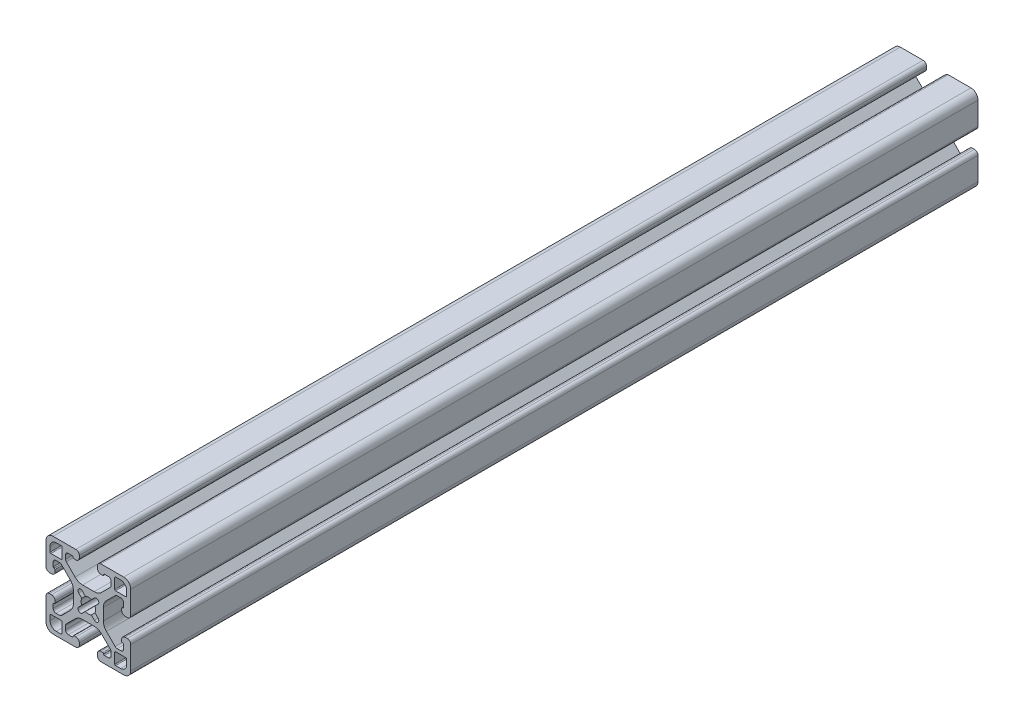
from build123d import *

# Parameters (mm, degrees)
EXTRUDE1_DEPTH = 381


with BuildPart() as part:
    # Sketch1 → Extrude1 (new body)
    with BuildSketch(Plane.XY):
        with BuildLine():
            Line((-46.536752228, -7.000622168), (-46.536752228, -8.774580164))
            ThreePointArc((-46.536752228, -8.774580164), (-46.907290083, -9.675221514), (-47.806745776, -10.048628264))
            Line((-47.806745776, -10.048628264), (-49.392633083, -10.048628264))
            ThreePointArc((-49.392633083, -10.048628264), (-49.878641042, -9.95195527), (-50.290658695, -9.676653876))
            Line((-50.290658695, -9.676653876), (-54.238761565, -5.728551005))
            ThreePointArc((-54.238761565, -5.728551005), (-55.26838878, -4.187604983), (-55.629945776, -2.369935216))
            Line((-55.629945776, -2.369935216), (-55.629945776, 2.846678689))
            ThreePointArc((-55.629945776, 2.846678689), (-55.26838878, 4.664348456), (-54.238761565, 6.205294478))
            Line((-54.238761565, 6.205294478), (-50.290658695, 10.153397348))
            ThreePointArc((-50.290658695, 10.153397348), (-49.878641042, 10.428698742), (-49.392633083, 10.525371736))
            Line((-49.392633083, 10.525371736), (-47.806745776, 10.525371736))
            ThreePointArc((-47.806745776, 10.525371736), (-46.907290079, 10.151964982), (-46.536752228, 9.251323623))
            Line((-46.536752228, 9.251323623), (-46.536752228, 7.47736564))
            ThreePointArc((-46.536752228, 7.47736564), (-46.648344767, 7.207957418), (-46.91775299, 7.096364878))
            Line((-46.91775299, 7.096364878), (-46.993953142, 7.096364878))
            ThreePointArc((-46.993953142, 7.096364878), (-47.263362671, 6.984771032), (-47.374953904, 6.715360422))
            Line((-47.374953904, 6.715360422), (-47.374945776, 5.877156465))
            ThreePointArc((-47.374945776, 5.877156465), (-46.913692136, 4.763614578), (-45.800145776, 4.302371736))
            Line((-45.800145776, 4.302371736), (-44.885745776, 4.302371736))
            ThreePointArc((-44.885745776, 4.302371736), (-43.772194017, 4.763619977), (-43.310945776, 5.877171736))
            Line((-43.310945776, 5.877171736), (-43.310945776, 16.113371736))
            ThreePointArc((-43.310945776, 16.113371736), (-44.240881746, 18.358435766), (-46.485945776, 19.288371736))
            Line((-46.485945776, 19.288371736), (-56.722145776, 19.288371736))
            ThreePointArc((-56.722145776, 19.288371736), (-57.835697535, 18.827123495), (-58.296945776, 17.713571736))
            Line((-58.296945776, 17.713571736), (-58.296945776, 16.799171736))
            ThreePointArc((-58.296945776, 16.799171736), (-57.835702934, 15.685625376), (-56.722161047, 15.224371736))
            Line((-56.722161047, 15.224371736), (-55.883957091, 15.224363608))
            ThreePointArc((-55.883957091, 15.224363608), (-55.61454648, 15.335954841), (-55.502952634, 15.60536437))
            Line((-55.502952634, 15.60536437), (-55.502952634, 15.681564523))
            ThreePointArc((-55.502952634, 15.681564523), (-55.391360095, 15.950972745), (-55.121951872, 16.062565285))
            Line((-55.121951872, 16.062565285), (-53.347993876, 16.062565285))
            ThreePointArc((-53.347993876, 16.062565285), (-52.447352526, 15.692027429), (-52.073945776, 14.792571736))
            Line((-52.073945776, 14.792571736), (-52.073945776, 13.206684429))
            ThreePointArc((-52.073945776, 13.206684429), (-52.17061877, 12.72067647), (-52.445920164, 12.308658817))
            Line((-52.445920164, 12.308658817), (-56.394023034, 8.360555947))
            ThreePointArc((-56.394023034, 8.360555947), (-57.934969057, 7.330928733), (-59.752638824, 6.969371736))
            Line((-59.752638824, 6.969371736), (-64.969252728, 6.969371736))
            ThreePointArc((-64.969252728, 6.969371736), (-66.786922496, 7.330928733), (-68.327868518, 8.360555947))
            Line((-68.327868518, 8.360555947), (-72.275971388, 12.308658817))
            ThreePointArc((-72.275971388, 12.308658817), (-72.551272782, 12.72067647), (-72.647945776, 13.206684429))
            Line((-72.647945776, 13.206684429), (-72.647945776, 14.792571736))
            ThreePointArc((-72.647945776, 14.792571736), (-72.274539022, 15.692027434), (-71.373897663, 16.062565285))
            Line((-71.373897663, 16.062565285), (-69.59993968, 16.062565285))
            ThreePointArc((-69.59993968, 16.062565285), (-69.330531458, 15.950972745), (-69.218938918, 15.681564523))
            Line((-69.218938918, 15.681564523), (-69.218938918, 15.60536437))
            ThreePointArc((-69.218938918, 15.60536437), (-69.107345072, 15.335954841), (-68.837934461, 15.224363608))
            Line((-68.837934461, 15.224363608), (-67.999730505, 15.224371736))
            ThreePointArc((-67.999730505, 15.224371736), (-66.886188618, 15.685625376), (-66.424945776, 16.799171736))
            Line((-66.424945776, 16.799171736), (-66.424945776, 17.713571736))
            ThreePointArc((-66.424945776, 17.713571736), (-66.886194017, 18.827123495), (-67.999745776, 19.288371736))
            Line((-67.999745776, 19.288371736), (-78.235945776, 19.288371736))
            ThreePointArc((-78.235945776, 19.288371736), (-80.481009806, 18.358435766), (-81.410945776, 16.113371736))
            Line((-81.410945776, 16.113371736), (-81.410945776, 5.877171736))
            ThreePointArc((-81.410945776, 5.877171736), (-80.949697535, 4.763619977), (-79.836145776, 4.302371736))
            Line((-79.836145776, 4.302371736), (-78.921745776, 4.302371736))
            ThreePointArc((-78.921745776, 4.302371736), (-77.808199416, 4.763614578), (-77.346945776, 5.877156465))
            Line((-77.346945776, 5.877156465), (-77.346937648, 6.715360422))
            ThreePointArc((-77.346937648, 6.715360422), (-77.458528881, 6.984771032), (-77.72793841, 7.096364878))
            Line((-77.72793841, 7.096364878), (-77.804138562, 7.096364878))
            ThreePointArc((-77.804138562, 7.096364878), (-78.073546785, 7.207957418), (-78.185139324, 7.47736564))
            Line((-78.185139324, 7.47736564), (-78.185139324, 9.251323637))
            ThreePointArc((-78.185139324, 9.251323637), (-77.814601469, 10.151964987), (-76.915145776, 10.525371736))
            Line((-76.915145776, 10.525371736), (-75.329258469, 10.525371736))
            ThreePointArc((-75.329258469, 10.525371736), (-74.84325051, 10.428698742), (-74.431232857, 10.153397348))
            Line((-74.431232857, 10.153397348), (-70.483129987, 6.205294478))
            ThreePointArc((-70.483129987, 6.205294478), (-69.453502773, 4.664348456), (-69.091945776, 2.846678689))
            Line((-69.091945776, 2.846678689), (-69.091945776, -2.369935216))
            ThreePointArc((-69.091945776, -2.369935216), (-69.453502773, -4.187604983), (-70.483129987, -5.728551005))
            Line((-70.483129987, -5.728551005), (-74.431232857, -9.676653876))
            ThreePointArc((-74.431232857, -9.676653876), (-74.84325051, -9.95195527), (-75.329258469, -10.048628264))
            Line((-75.329258469, -10.048628264), (-76.915145776, -10.048628264))
            ThreePointArc((-76.915145776, -10.048628264), (-77.814601474, -9.67522151), (-78.185139324, -8.774580151))
            Line((-78.185139324, -8.774580151), (-78.185139324, -7.000622168))
            ThreePointArc((-78.185139324, -7.000622168), (-78.073546785, -6.731213945), (-77.804138562, -6.619621406))
            Line((-77.804138562, -6.619621406), (-77.72793841, -6.619621406))
            ThreePointArc((-77.72793841, -6.619621406), (-77.458528881, -6.50802756), (-77.346937648, -6.238616949))
            Line((-77.346937648, -6.238616949), (-77.346945776, -5.400412993))
            ThreePointArc((-77.346945776, -5.400412993), (-77.808199416, -4.286871106), (-78.921745776, -3.825628264))
            Line((-78.921745776, -3.825628264), (-79.836145776, -3.825628264))
            ThreePointArc((-79.836145776, -3.825628264), (-80.949697535, -4.286876505), (-81.410945776, -5.400428264))
            Line((-81.410945776, -5.400428264), (-81.410945776, -15.636628264))
            ThreePointArc((-81.410945776, -15.636628264), (-80.481009806, -17.881692294), (-78.235945776, -18.811628264))
            Line((-78.235945776, -18.811628264), (-67.999745776, -18.811628264))
            ThreePointArc((-67.999745776, -18.811628264), (-66.886194017, -18.350380023), (-66.424945776, -17.236828264))
            Line((-66.424945776, -17.236828264), (-66.424945776, -16.322428264))
            ThreePointArc((-66.424945776, -16.322428264), (-66.886188618, -15.208881904), (-67.999730505, -14.747628264))
            Line((-67.999730505, -14.747628264), (-68.837934461, -14.747620136))
            ThreePointArc((-68.837934461, -14.747620136), (-69.107345072, -14.859211369), (-69.218938918, -15.128620898))
            Line((-69.218938918, -15.128620898), (-69.218938918, -15.20482105))
            ThreePointArc((-69.218938918, -15.20482105), (-69.330531458, -15.474229273), (-69.59993968, -15.585821812))
            Line((-69.59993968, -15.585821812), (-71.373897676, -15.585821812))
            ThreePointArc((-71.373897676, -15.585821812), (-72.274539027, -15.215283957), (-72.647945776, -14.315828264))
            Line((-72.647945776, -14.315828264), (-72.647945776, -12.729940957))
            ThreePointArc((-72.647945776, -12.729940957), (-72.551272782, -12.243932998), (-72.275971388, -11.831915345))
            Line((-72.275971388, -11.831915345), (-68.327868518, -7.883812475))
            ThreePointArc((-68.327868518, -7.883812475), (-66.786922496, -6.85418526), (-64.969252728, -6.492628264))
            Line((-64.969252728, -6.492628264), (-59.752638824, -6.492628264))
            ThreePointArc((-59.752638824, -6.492628264), (-57.934969057, -6.85418526), (-56.394023034, -7.883812475))
            Line((-56.394023034, -7.883812475), (-52.445920164, -11.831915345))
            ThreePointArc((-52.445920164, -11.831915345), (-52.17061877, -12.243932998), (-52.073945776, -12.729940957))
            Line((-52.073945776, -12.729940957), (-52.073945776, -14.315828264))
            ThreePointArc((-52.073945776, -14.315828264), (-52.44735253, -15.215283961), (-53.347993889, -15.585821812))
            Line((-53.347993889, -15.585821812), (-55.121951872, -15.585821812))
            ThreePointArc((-55.121951872, -15.585821812), (-55.391360095, -15.474229273), (-55.502952634, -15.20482105))
            Line((-55.502952634, -15.20482105), (-55.502952634, -15.128620898))
            ThreePointArc((-55.502952634, -15.128620898), (-55.61454648, -14.859211369), (-55.883957091, -14.747620136))
            Line((-55.883957091, -14.747620136), (-56.722161047, -14.747628264))
            ThreePointArc((-56.722161047, -14.747628264), (-57.835702934, -15.208881904), (-58.296945776, -16.322428264))
            Line((-58.296945776, -16.322428264), (-58.296945776, -17.236828264))
            ThreePointArc((-58.296945776, -17.236828264), (-57.835697535, -18.350380023), (-56.722145776, -18.811628264))
            Line((-56.722145776, -18.811628264), (-46.485945776, -18.811628264))
            ThreePointArc((-46.485945776, -18.811628264), (-44.240881746, -17.881692294), (-43.310945776, -15.636628264))
            Line((-43.310945776, -15.636628264), (-43.310945776, -5.400428264))
            ThreePointArc((-43.310945776, -5.400428264), (-43.772194017, -4.286876505), (-44.885745776, -3.825628264))
            Line((-44.885745776, -3.825628264), (-45.800145776, -3.825628264))
            ThreePointArc((-45.800145776, -3.825628264), (-46.913692136, -4.286871106), (-47.374945776, -5.400412993))
            Line((-47.374945776, -5.400412993), (-47.374953904, -6.238616949))
            ThreePointArc((-47.374953904, -6.238616949), (-47.263362671, -6.50802756), (-46.993953142, -6.619621406))
            Line((-46.993953142, -6.619621406), (-46.91775299, -6.619621406))
            ThreePointArc((-46.91775299, -6.619621406), (-46.648344767, -6.731213945), (-46.536752228, -7.000622168))
        make_face()
        with BuildLine():
            Line((-66.704246649, -2.488483035), (-65.333825803, -1.118062189))
            ThreePointArc((-65.333825803, -1.118062189), (-65.628655776, 0.238371736), (-65.333825803, 1.594805661))
            Line((-65.333825803, 1.594805661), (-66.704246649, 2.965226507))
            ThreePointArc((-66.704246649, 2.965226507), (-66.704246649, 4.581672609), (-65.087800547, 4.581672609))
            Line((-65.087800547, 4.581672609), (-63.717379701, 3.211251763))
            ThreePointArc((-63.717379701, 3.211251763), (-62.360945776, 3.506081736), (-61.004511851, 3.211251763))
            Line((-61.004511851, 3.211251763), (-59.721184579, 4.483982556))
            ThreePointArc((-59.721184579, 4.483982556), (-58.017644903, 4.581672609), (-58.115334956, 2.878132934))
            Line((-58.115334956, 2.878132934), (-59.38806575, 1.594805661))
            ThreePointArc((-59.38806575, 1.594805661), (-59.093235776, 0.238371736), (-59.38806575, -1.118062189))
            Line((-59.38806575, -1.118062189), (-58.017644903, -2.488483035))
            ThreePointArc((-58.017644903, -2.488483035), (-58.017644903, -4.104929137), (-59.634091005, -4.104929137))
            Line((-59.634091005, -4.104929137), (-61.004511851, -2.73450829))
            ThreePointArc((-61.004511851, -2.73450829), (-62.360945776, -3.029338264), (-63.717379701, -2.73450829))
            Line((-63.717379701, -2.73450829), (-65.087800547, -4.104929137))
            ThreePointArc((-65.087800547, -4.104929137), (-66.704246649, -4.104929137), (-66.704246649, -2.488483035))
        make_face(mode=Mode.SUBTRACT)
        with BuildLine():
            Line((-79.607545776, 12.481171736), (-79.607545776, 14.690971736))
            ThreePointArc((-79.607545776, 14.690971736), (-78.789202123, 16.666628083), (-76.813545776, 17.484971736))
            Line((-76.813545776, 17.484971736), (-74.603745776, 17.484971736))
            ThreePointArc((-74.603745776, 17.484971736), (-74.334338092, 17.37337942), (-74.222745776, 17.103971736))
            Line((-74.222745776, 17.103971736), (-74.222745776, 12.481171736))
            ThreePointArc((-74.222745776, 12.481171736), (-74.334338092, 12.211764053), (-74.603745776, 12.100171736))
            Line((-74.603745776, 12.100171736), (-79.226545776, 12.100171736))
            ThreePointArc((-79.226545776, 12.100171736), (-79.49595346, 12.211764053), (-79.607545776, 12.481171736))
        make_face(mode=Mode.SUBTRACT)
        with BuildLine():
            Line((-74.603745776, -17.008228264), (-76.813545776, -17.008228264))
            ThreePointArc((-76.813545776, -17.008228264), (-78.789202123, -16.18988461), (-79.607545776, -14.214228264))
            Line((-79.607545776, -14.214228264), (-79.607545776, -12.004428264))
            ThreePointArc((-79.607545776, -12.004428264), (-79.49595346, -11.73502058), (-79.226545776, -11.623428264))
            Line((-79.226545776, -11.623428264), (-74.603745776, -11.623428264))
            ThreePointArc((-74.603745776, -11.623428264), (-74.334338092, -11.73502058), (-74.222745776, -12.004428264))
            Line((-74.222745776, -12.004428264), (-74.222745776, -16.627228264))
            ThreePointArc((-74.222745776, -16.627228264), (-74.334338092, -16.896635947), (-74.603745776, -17.008228264))
        make_face(mode=Mode.SUBTRACT)
        with BuildLine():
            Line((-45.114345776, -12.004428264), (-45.114345776, -14.214228264))
            ThreePointArc((-45.114345776, -14.214228264), (-45.932689429, -16.18988461), (-47.908345776, -17.008228264))
            Line((-47.908345776, -17.008228264), (-50.118145776, -17.008228264))
            ThreePointArc((-50.118145776, -17.008228264), (-50.38755346, -16.896635947), (-50.499145776, -16.627228264))
            Line((-50.499145776, -16.627228264), (-50.499145776, -12.004428264))
            ThreePointArc((-50.499145776, -12.004428264), (-50.38755346, -11.73502058), (-50.118145776, -11.623428264))
            Line((-50.118145776, -11.623428264), (-45.495345776, -11.623428264))
            ThreePointArc((-45.495345776, -11.623428264), (-45.225938092, -11.73502058), (-45.114345776, -12.004428264))
        make_face(mode=Mode.SUBTRACT)
        with BuildLine():
            Line((-50.118145776, 17.484971736), (-47.908345776, 17.484971736))
            ThreePointArc((-47.908345776, 17.484971736), (-45.932689429, 16.666628083), (-45.114345776, 14.690971736))
            Line((-45.114345776, 14.690971736), (-45.114345776, 12.481171736))
            ThreePointArc((-45.114345776, 12.481171736), (-45.225938092, 12.211764053), (-45.495345776, 12.100171736))
            Line((-45.495345776, 12.100171736), (-50.118145776, 12.100171736))
            ThreePointArc((-50.118145776, 12.100171736), (-50.38755346, 12.211764053), (-50.499145776, 12.481171736))
            Line((-50.499145776, 12.481171736), (-50.499145776, 17.103971736))
            ThreePointArc((-50.499145776, 17.103971736), (-50.38755346, 17.37337942), (-50.118145776, 17.484971736))
        make_face(mode=Mode.SUBTRACT)
    extrude(amount=-EXTRUDE1_DEPTH)


solid = part.part
